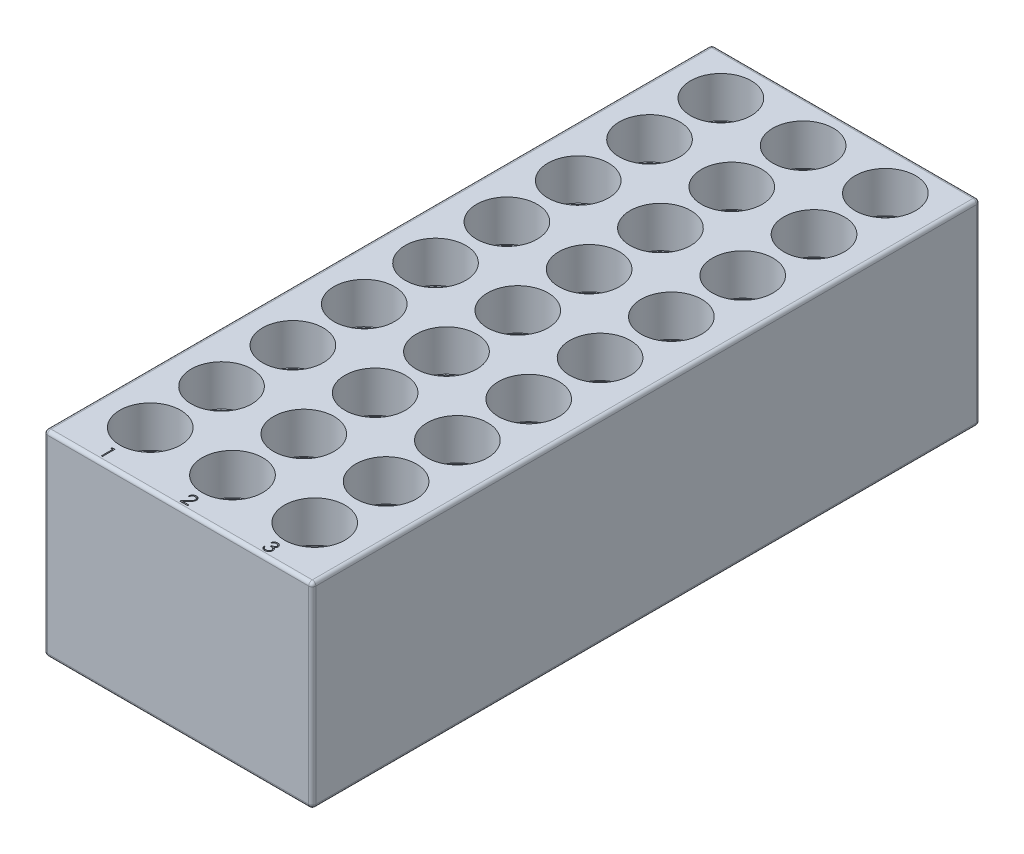
from build123d import *

# Parameters (mm, degrees)
SKETCH1_W            = 75.25
SKETCH1_H            = 187.25
SKETCH1_R            = 8.5
BOSS_EXTRUDE1_DEPTH  = 50
SKETCH3_W            = 75.25
SKETCH3_H            = 187.25
BOSS_EXTRUDE2_DEPTH  = 5
SKETCH5_R            = 8.5
SKETCH5_R_2          = 8.1
BOSS_EXTRUDE4_DEPTH  = 38.5
LPATTERN1_COUNT      = 3
LPATTERN1_PITCH      = 23
LPATTERN1_COUNT_DIR2 = 9
LPATTERN1_PITCH_DIR2 = 20
CUT_EXTRUDE1_DEPTH   = 0.5
FILLET1_R            = 1


with BuildPart() as part:
    # Sketch1 → Boss-Extrude1 (new body)
    with BuildSketch(Plane(origin=(0, 0, 0), x_dir=(1, 0, 0), z_dir=(0, 1, 0))):
        Rectangle(SKETCH1_W, SKETCH1_H)
        with Locations(Location((-23.0625, 81.625, 0), (0, 0, 270))):
            Circle(SKETCH1_R, mode=Mode.SUBTRACT)
        with Locations(Location((0, 81.625, 0), (0, 0, 270))):
            Circle(SKETCH1_R, mode=Mode.SUBTRACT)
        with Locations(Location((23.0625, 81.625, 0), (0, 0, 270))):
            Circle(SKETCH1_R, mode=Mode.SUBTRACT)
        with Locations(Location((-23.0625, 61.625, 0), (0, 0, 270))):
            Circle(SKETCH1_R, mode=Mode.SUBTRACT)
        with Locations(Location((0, 61.625, 0), (0, 0, 270))):
            Circle(SKETCH1_R, mode=Mode.SUBTRACT)
        with Locations(Location((23.0625, 61.625, 0), (0, 0, 270))):
            Circle(SKETCH1_R, mode=Mode.SUBTRACT)
        with Locations(Location((-23.0625, 41.625, 0), (0, 0, 270))):
            Circle(SKETCH1_R, mode=Mode.SUBTRACT)
        with Locations(Location((0, 41.625, 0), (0, 0, 270))):
            Circle(SKETCH1_R, mode=Mode.SUBTRACT)
        with Locations(Location((23.0625, 41.625, 0), (0, 0, 270))):
            Circle(SKETCH1_R, mode=Mode.SUBTRACT)
        with Locations(Location((-23.0625, 21.625, 0), (0, 0, 270))):
            Circle(SKETCH1_R, mode=Mode.SUBTRACT)
        with Locations(Location((0, 21.625, 0), (0, 0, 270))):
            Circle(SKETCH1_R, mode=Mode.SUBTRACT)
        with Locations(Location((23.0625, 21.625, 0), (0, 0, 270))):
            Circle(SKETCH1_R, mode=Mode.SUBTRACT)
        with Locations(Location((-23.0625, 1.625, 0), (0, 0, 270))):
            Circle(SKETCH1_R, mode=Mode.SUBTRACT)
        with Locations(Location((0, 1.625, 0), (0, 0, 270))):
            Circle(SKETCH1_R, mode=Mode.SUBTRACT)
        with Locations(Location((23.0625, 1.625, 0), (0, 0, 270))):
            Circle(SKETCH1_R, mode=Mode.SUBTRACT)
        with Locations(Location((-23.0625, -18.375, 0), (0, 0, 270))):
            Circle(SKETCH1_R, mode=Mode.SUBTRACT)
        with Locations(Location((0, -18.375, 0), (0, 0, 270))):
            Circle(SKETCH1_R, mode=Mode.SUBTRACT)
        with Locations(Location((23.0625, -18.375, 0), (0, 0, 270))):
            Circle(SKETCH1_R, mode=Mode.SUBTRACT)
        with Locations(Location((-23.0625, -38.375, 0), (0, 0, 270))):
            Circle(SKETCH1_R, mode=Mode.SUBTRACT)
        with Locations(Location((0, -38.375, 0), (0, 0, 270))):
            Circle(SKETCH1_R, mode=Mode.SUBTRACT)
        with Locations(Location((23.0625, -38.375, 0), (0, 0, 270))):
            Circle(SKETCH1_R, mode=Mode.SUBTRACT)
        with Locations(Location((-23.0625, -58.375, 0), (0, 0, 270))):
            Circle(SKETCH1_R, mode=Mode.SUBTRACT)
        with Locations(Location((0, -58.375, 0), (0, 0, 270))):
            Circle(SKETCH1_R, mode=Mode.SUBTRACT)
        with Locations(Location((23.0625, -58.375, 0), (0, 0, 270))):
            Circle(SKETCH1_R, mode=Mode.SUBTRACT)
        with Locations(Location((-23.0625, -78.375, 0), (0, 0, 270))):
            Circle(SKETCH1_R, mode=Mode.SUBTRACT)
        with Locations(Location((0, -78.375, 0), (0, 0, 270))):
            Circle(SKETCH1_R, mode=Mode.SUBTRACT)
        with Locations(Location((23.0625, -78.375, 0), (0, 0, 270))):
            Circle(SKETCH1_R, mode=Mode.SUBTRACT)
    extrude(amount=BOSS_EXTRUDE1_DEPTH)

    # Sketch3 → Boss-Extrude2 (add)
    with BuildSketch(Plane.XZ):
        Rectangle(SKETCH3_W, SKETCH3_H)
    extrude(amount=BOSS_EXTRUDE2_DEPTH)

    # Sketch5 → Boss-Extrude4 (add)
    with BuildSketch(Plane(origin=(0, 0, 0), x_dir=(1, 0, 0), z_dir=(0, 1, 0))):
        with Locations(Location((-23.0625, 81.625, 0), (0, 0, 270))):
            Circle(SKETCH5_R)
        with Locations(Location((-23.0625, 81.625, 0), (0, 0, 270))):
            Circle(SKETCH5_R_2, mode=Mode.SUBTRACT)
    boss_extrude4 = extrude(amount=BOSS_EXTRUDE4_DEPTH)

    # LPattern1: Boss-Extrude4 3 × 9
    with Locations(*[(i * LPATTERN1_PITCH, 0, j * LPATTERN1_PITCH_DIR2) for i in range(LPATTERN1_COUNT) for j in range(LPATTERN1_COUNT_DIR2) if (i, j) != (0, 0)]):
        add(boss_extrude4)

    # Sketch4 → Cut-Extrude1 (cut)
    with BuildSketch(Plane(origin=(0, 50, 0), x_dir=(1, 0, 0), z_dir=(0, 1, 0))):
        Polygon((-23.39531817, -88.584389718), (-22.748182753, -88.584389718), (-22.748182753, -92.084389718), (-23.062285318, -92.084389718), (-23.062285318, -88.943364077), (-23.600746856, -88.943364077), align=None)
        with BuildLine():
            Line((-0.805875061, -89.661312795), (-1.119977625, -89.661312795))
            add(Edge.make_bspline(
                [(-1.119977625, -89.661312795), (-1.117930472, -89.619641907), (-1.113909918, -89.537801393), (-1.095081629, -89.418477486), (-1.068140752, -89.304422688), (-1.030049298, -89.196552774), (-0.98274302, -89.093913967), (-0.926012993, -88.996913951), (-0.858819142, -88.905922762), (-0.782612408, -88.821783919), (-0.699843769, -88.744596348), (-0.610537829, -88.677941105), (-0.516692802, -88.621623434), (-0.418593403, -88.574542192), (-0.31513284, -88.539202346), (-0.207249982, -88.512980707), (-0.094470845, -88.497204361), (-0.017630823, -88.495508575), (0.021448657, -88.494646129)],
                knots=[0, 0, 0, 0, 1.10065271, 2.161652631, 3.183658789, 4.190468796, 5.17591951, 6.163126047, 7.15150782, 8.156236427, 9.156009102, 10.134482811, 11.092018607, 12.041330605, 13.001268258, 13.972401359, 14.968799086, 16, 16, 16, 16], degree=3))
            add(Edge.make_bspline(
                [(0.021448657, -88.494646129), (0.059826731, -88.495544585), (0.135238276, -88.49731002), (0.24530029, -88.512471049), (0.350077584, -88.536216641), (0.449365351, -88.569532057), (0.542371416, -88.614316484), (0.62979446, -88.668114023), (0.712675271, -88.730333854), (0.787282055, -88.803587668), (0.855790134, -88.881790052), (0.914892389, -88.965277956), (0.965505552, -89.051507242), (1.007693232, -89.141135443), (1.038749371, -89.235006472), (1.062327579, -89.331753675), (1.075654993, -89.432378486), (1.077700416, -89.500485041), (1.078740323, -89.535110872)],
                knots=[0, 0, 0, 0, 1.111607364, 2.184268762, 3.212621178, 4.221274766, 5.211760367, 6.196651075, 7.1921475, 8.207485113, 9.220403448, 10.201281604, 11.166441695, 12.114753415, 13.065576456, 14.026450734, 14.996634279, 16, 16, 16, 16], degree=3))
            add(Edge.make_bspline(
                [(1.078740323, -89.535110872), (1.077047061, -89.583858707), (1.073690249, -89.68049892), (1.044975873, -89.822513783), (1.000129362, -89.960107202), (0.946132005, -90.070844504), (0.891659561, -90.160077998), (0.842572053, -90.233546703), (0.785107242, -90.312652171), (0.718428744, -90.397129509), (0.643915872, -90.487640414), (0.560893709, -90.584130209), (0.468770227, -90.685601979), (0.404111726, -90.75490758), (0.370607311, -90.790820007)],
                knots=[0, 0, 0, 0, 1.184426356, 2.348067706, 3.509069118, 4.696110526, 5.333549288, 6.050745305, 6.844228056, 7.710549037, 8.667450064, 9.695053472, 10.805634456, 12, 12, 12, 12], degree=3))
            Line((0.370607311, -90.790820007), (-0.505093811, -91.725415359))
            Line((-0.505093811, -91.725415359), (1.123612118, -91.725415359))
            Line((1.123612118, -91.725415359), (1.123612118, -92.084389718))
            Line((1.123612118, -92.084389718), (-1.25459301, -92.084389718))
            Line((-1.25459301, -92.084389718), (0.102778785, -90.63587209))
            add(Edge.make_bspline(
                [(0.102778785, -90.63587209), (0.135826672, -90.601373784), (0.199304899, -90.535109597), (0.289087476, -90.438366637), (0.369726464, -90.348617096), (0.441743857, -90.266030548), (0.503577362, -90.18939898), (0.558449594, -90.121204276), (0.602415185, -90.058449826), (0.650130581, -89.985709212), (0.696344562, -89.896896895), (0.736056918, -89.788363206), (0.760271767, -89.676635953), (0.763176602, -89.601133916), (0.764637759, -89.563155744)],
                knots=[0, 0, 0, 0, 1.329631726, 2.553950428, 3.673215718, 4.687767853, 5.603093632, 6.413772471, 7.123043292, 7.734684054, 8.834405432, 9.900288307, 10.943827018, 12, 12, 12, 12], degree=3))
            add(Edge.make_bspline(
                [(0.764637759, -89.563155744), (0.764002017, -89.539274346), (0.762749091, -89.492208695), (0.751691394, -89.423202936), (0.734980888, -89.356638122), (0.711035629, -89.292309503), (0.679428889, -89.230863851), (0.640955509, -89.172226371), (0.596565446, -89.115537406), (0.545214177, -89.062384108), (0.488802657, -89.013702902), (0.429208407, -88.970578817), (0.366158303, -88.934539706), (0.299918181, -88.904996209), (0.230672711, -88.881820828), (0.158287966, -88.865762248), (0.08296395, -88.855679764), (0.031530454, -88.854315592), (0.005322856, -88.853620488)],
                knots=[0, 0, 0, 0, 0.991446411, 1.95395049, 2.89581595, 3.838931463, 4.798493298, 5.75982156, 6.748411868, 7.785213223, 8.824556874, 9.840280684, 10.836137867, 11.835679398, 12.848801643, 13.863922112, 14.911575587, 16, 16, 16, 16], degree=3))
            add(Edge.make_bspline(
                [(0.005322856, -88.853620488), (-0.022047977, -88.85433552), (-0.075799773, -88.855739725), (-0.154718806, -88.865562389), (-0.230004584, -88.88250823), (-0.301846487, -88.905684904), (-0.370366073, -88.935143453), (-0.435230117, -88.971835197), (-0.496293006, -89.015618691), (-0.553669529, -89.065259247), (-0.606533508, -89.120526848), (-0.652980384, -89.182136811), (-0.693564398, -89.248964227), (-0.728973632, -89.320828777), (-0.757729322, -89.398382557), (-0.779702472, -89.481350262), (-0.797089319, -89.569371643), (-0.80289784, -89.630156728), (-0.805875061, -89.661312795)],
                knots=[0, 0, 0, 0, 1.031018746, 2.02475058, 2.990194455, 3.934040569, 4.864654155, 5.795059489, 6.735614925, 7.690564532, 8.649604399, 9.611025574, 10.590972636, 11.591080095, 12.624614302, 13.701020113, 14.821632451, 16, 16, 16, 16], degree=3))
        make_face()
        with BuildLine():
            Line((22.078740323, -89.392082026), (21.764637759, -89.392082026))
            add(Edge.make_bspline(
                [(21.764637759, -89.392082026), (21.77314731, -89.356849542), (21.789782786, -89.287972918), (21.824480359, -89.189565657), (21.862279614, -89.096442135), (21.907668719, -89.010346062), (21.957177473, -88.929547159), (22.013900195, -88.855878035), (22.075219917, -88.787465069), (22.143044866, -88.726751831), (22.214173528, -88.671774102), (22.289608148, -88.624899045), (22.367831042, -88.584574892), (22.449384174, -88.55135466), (22.534510346, -88.526329137), (22.62243997, -88.508172331), (22.71340347, -88.496381217), (22.77515106, -88.495230454), (22.806504747, -88.494646129)],
                knots=[0, 0, 0, 0, 1.162005537, 2.271625781, 3.343758855, 4.383309926, 5.390229558, 6.379919256, 7.361854164, 8.333198761, 9.295911338, 10.242430842, 11.177959212, 12.116337295, 13.062827104, 14.020064771, 14.994644689, 16, 16, 16, 16], degree=3))
            add(Edge.make_bspline(
                [(22.806504747, -88.494646129), (22.852187489, -88.496025359), (22.9425565, -88.498753734), (23.075319547, -88.523668171), (23.203346366, -88.563093303), (23.325235613, -88.61756703), (23.438454046, -88.684754343), (23.539190233, -88.76471908), (23.626078744, -88.855918382), (23.698973121, -88.956650946), (23.75604812, -89.064306456), (23.798134494, -89.175106613), (23.823756175, -89.288788584), (23.827076732, -89.365545863), (23.828740323, -89.404001097)],
                knots=[0, 0, 0, 0, 1.083050992, 2.142477498, 3.193116406, 4.255571735, 5.30263384, 6.308962982, 7.297363603, 8.282367274, 9.249857812, 10.179914175, 11.08814088, 12, 12, 12, 12], degree=3))
            add(Edge.make_bspline(
                [(23.828740323, -89.404001097), (23.827576732, -89.441007891), (23.825299765, -89.513424446), (23.80596606, -89.619145943), (23.773429797, -89.718787543), (23.728360034, -89.812768705), (23.670018484, -89.900493545), (23.599345787, -89.982159436), (23.515843125, -90.058128594), (23.452564187, -90.101648067), (23.419986317, -90.12405318)],
                knots=[0, 0, 0, 0, 1.024540389, 2.004866551, 2.965041327, 3.920577974, 4.882998113, 5.874504559, 6.905732034, 8, 8, 8, 8], degree=3))
            add(Edge.make_bspline(
                [(23.419986317, -90.12405318), (23.457218072, -90.142031351), (23.530984946, -90.177651309), (23.631535475, -90.247507067), (23.722813351, -90.328163414), (23.77371707, -90.391106067), (23.799293208, -90.422731064)],
                knots=[0, 0, 0, 0, 1.015518401, 2.012035669, 3.001164323, 4, 4, 4, 4], degree=3))
            add(Edge.make_bspline(
                [(23.799293208, -90.422731064), (23.81613455, -90.445788816), (23.849541447, -90.491526733), (23.89077698, -90.565063159), (23.928186095, -90.639414648), (23.957336314, -90.716574054), (23.979910181, -90.795647068), (23.996046213, -90.876769464), (24.006070354, -90.960007486), (24.007505906, -91.016319966), (24.008227503, -91.044626097)],
                knots=[0, 0, 0, 0, 1.025084078, 2.033381695, 3.024893161, 4.013698104, 4.991890475, 5.976764909, 6.982997093, 8, 8, 8, 8], degree=3))
            add(Edge.make_bspline(
                [(24.008227503, -91.044626097), (24.006432989, -91.093635818), (24.002852407, -91.19142462), (23.970848333, -91.335899341), (23.921235092, -91.477124843), (23.850778156, -91.612199683), (23.764910648, -91.738580064), (23.662753323, -91.851656373), (23.545466915, -91.948854977), (23.414661266, -92.030065205), (23.272944138, -92.094983127), (23.121368546, -92.14004057), (22.962118492, -92.16938657), (22.852911194, -92.172533439), (22.797390163, -92.174133308)],
                knots=[0, 0, 0, 0, 0.955779014, 1.907060117, 2.875433937, 3.871313158, 4.872415639, 5.851225146, 6.836215519, 7.83643374, 8.849228613, 9.86973379, 10.916971861, 12, 12, 12, 12], degree=3))
            add(Edge.make_bspline(
                [(22.797390163, -92.174133308), (22.759970863, -92.173265095), (22.686342158, -92.171556741), (22.578098659, -92.159878139), (22.47477696, -92.138548134), (22.376237362, -92.109844829), (22.282392326, -92.073453087), (22.193528221, -92.028134389), (22.109098327, -91.974822887), (22.029899376, -91.912889299), (21.955940808, -91.843607959), (21.889188084, -91.765748949), (21.828528291, -91.680751545), (21.775585652, -91.587628489), (21.7279487, -91.487583232), (21.688767743, -91.379334733), (21.654282175, -91.263850711), (21.63824871, -91.183372971), (21.630022375, -91.142082026)],
                knots=[0, 0, 0, 0, 1.048658725, 2.063410685, 3.046034179, 4.001477787, 4.936774919, 5.862367409, 6.792675028, 7.730719943, 8.675894397, 9.627829632, 10.600096036, 11.597688215, 12.626045268, 13.701542398, 14.82072376, 16, 16, 16, 16], degree=3))
            Line((21.630022375, -91.142082026), (21.944124939, -91.142082026))
            add(Edge.make_bspline(
                [(21.944124939, -91.142082026), (21.95230823, -91.169031039), (21.968225443, -91.221449211), (21.995319741, -91.296889517), (22.026188013, -91.36604757), (22.059302572, -91.429430692), (22.094081018, -91.487663094), (22.132995943, -91.539204963), (22.173165088, -91.586320165), (22.203444441, -91.612864777), (22.218263561, -91.625856064)],
                knots=[0, 0, 0, 0, 1.198163088, 2.33053128, 3.407730985, 4.417276592, 5.372219308, 6.28897303, 7.162600585, 8, 8, 8, 8], degree=3))
            add(Edge.make_bspline(
                [(22.218263561, -91.625856064), (22.237860137, -91.640964398), (22.2769928, -91.67113443), (22.340761031, -91.709636059), (22.407825917, -91.742997084), (22.479640591, -91.76848078), (22.554655362, -91.790058441), (22.634082727, -91.80417896), (22.717221944, -91.813867131), (22.773989708, -91.814722062), (22.802999138, -91.815158949)],
                knots=[0, 0, 0, 0, 0.946170439, 1.889420265, 2.845303464, 3.807233317, 4.801018734, 5.828864929, 6.890507805, 8, 8, 8, 8], degree=3))
            add(Edge.make_bspline(
                [(22.802999138, -91.815158949), (22.83575264, -91.814543044), (22.899799287, -91.813338694), (22.993254146, -91.802262987), (23.082161594, -91.786132574), (23.16553452, -91.761219591), (23.244465027, -91.73043874), (23.317846677, -91.691790334), (23.386642783, -91.646445613), (23.449972188, -91.594906454), (23.506917696, -91.538484959), (23.557057209, -91.479471888), (23.599681871, -91.418116058), (23.634065449, -91.354077937), (23.661215999, -91.287622709), (23.6796992, -91.218563879), (23.692550715, -91.147466613), (23.693597327, -91.099137644), (23.694124939, -91.074774334)],
                knots=[0, 0, 0, 0, 1.217147791, 2.380027433, 3.494444702, 4.572153297, 5.609568379, 6.639424714, 7.649109417, 8.668170816, 9.669597737, 10.625200337, 11.543417969, 12.441394052, 13.322311151, 14.205496177, 15.095365482, 16, 16, 16, 16], degree=3))
            add(Edge.make_bspline(
                [(23.694124939, -91.074774334), (23.692594637, -91.042162995), (23.689541649, -90.977102587), (23.666233069, -90.881385012), (23.627894205, -90.7891616), (23.574221694, -90.70200581), (23.508885965, -90.621229908), (23.432521058, -90.549158426), (23.34449283, -90.489688335), (23.263472961, -90.448599678), (23.191707804, -90.420562603), (23.13029242, -90.401887639), (23.061535817, -90.386073983), (22.986269468, -90.371361711), (22.903926251, -90.358840363), (22.814595813, -90.348398548), (22.718260052, -90.340043507), (22.651568886, -90.336312411), (22.617201862, -90.334389718)],
                knots=[0, 0, 0, 0, 1.07054697, 2.135767047, 3.216561865, 4.33974944, 5.486079747, 6.621378074, 7.775625952, 8.963672916, 9.598146892, 10.304877434, 11.070270905, 11.915000392, 12.823868403, 13.805723172, 14.86925407, 16, 16, 16, 16], degree=3))
            Line((22.617201862, -90.334389718), (22.617201862, -89.975415359))
            add(Edge.make_bspline(
                [(22.617201862, -89.975415359), (22.660503028, -89.974680556), (22.745319374, -89.973241256), (22.869213679, -89.955833245), (22.987686991, -89.931752617), (23.098113733, -89.894867425), (23.198762446, -89.852027128), (23.286082049, -89.802174919), (23.358849196, -89.746760169), (23.416710267, -89.68492756), (23.460239496, -89.618612512), (23.492066293, -89.549495855), (23.51086662, -89.476971794), (23.513376287, -89.427477126), (23.514637759, -89.402598853)],
                knots=[0, 0, 0, 0, 1.321986639, 2.589447074, 3.816329219, 5.01088745, 6.139805852, 7.153945165, 8.075214402, 8.924034688, 9.728124013, 10.488707548, 11.240355623, 12, 12, 12, 12], degree=3))
            add(Edge.make_bspline(
                [(23.514637759, -89.402598853), (23.514223348, -89.384321108), (23.513398897, -89.347958401), (23.50300162, -89.294833332), (23.487377579, -89.243332386), (23.465897849, -89.193674576), (23.437147651, -89.146204302), (23.402741664, -89.100516853), (23.361773564, -89.056873074), (23.314828117, -89.016192754), (23.264416312, -88.977423517), (23.209166537, -88.94450988), (23.150744662, -88.916364818), (23.089086007, -88.893155316), (23.023990477, -88.875696028), (22.955763919, -88.863160186), (22.884276236, -88.855322532), (22.835504504, -88.854194116), (22.810711477, -88.853620488)],
                knots=[0, 0, 0, 0, 0.884392785, 1.759457502, 2.611959086, 3.489218968, 4.37281399, 5.2945488, 6.255912374, 7.266815255, 8.301784654, 9.332968512, 10.37626691, 11.440494194, 12.520033166, 13.637162961, 14.798855837, 16, 16, 16, 16], degree=3))
            add(Edge.make_bspline(
                [(22.810711477, -88.853620488), (22.770859809, -88.85501185), (22.693020233, -88.857729503), (22.580805316, -88.881532517), (22.476485982, -88.9195106), (22.396747315, -88.96484362), (22.337864741, -89.009594053), (22.295787803, -89.04867644), (22.254467293, -89.092109263), (22.216621616, -89.142567639), (22.178347639, -89.196634429), (22.143503078, -89.25705811), (22.109643385, -89.322262505), (22.089240836, -89.368358139), (22.078740323, -89.392082026)],
                knots=[0, 0, 0, 0, 1.472543308, 2.876219568, 4.221790263, 5.565193594, 6.249813518, 6.953379497, 7.687249741, 8.463570142, 9.283606569, 10.136032583, 11.040678096, 12, 12, 12, 12], degree=3))
        make_face()
    extrude(amount=-CUT_EXTRUDE1_DEPTH, mode=Mode.SUBTRACT)

    # Fillet1
    fillet1_edges = [part.edges().sort_by_distance(p)[0] for p in [
        (-37.625, -5, 0),
        (0, -5, -93.625),
        (37.625, -5, 0),
        (37.625, 50, 0),
        (0, -5, 93.625),
        (0, 50, -93.625),
        (-37.625, 50, 0),
        (-37.625, 22.5, -93.625),
        (37.625, 22.5, -93.625),
        (37.625, 22.5, 93.625),
        (-37.625, 22.5, 93.625),
        (0, 50, 93.625),
    ]]
    fillet(fillet1_edges, radius=FILLET1_R)


solid = part.part
